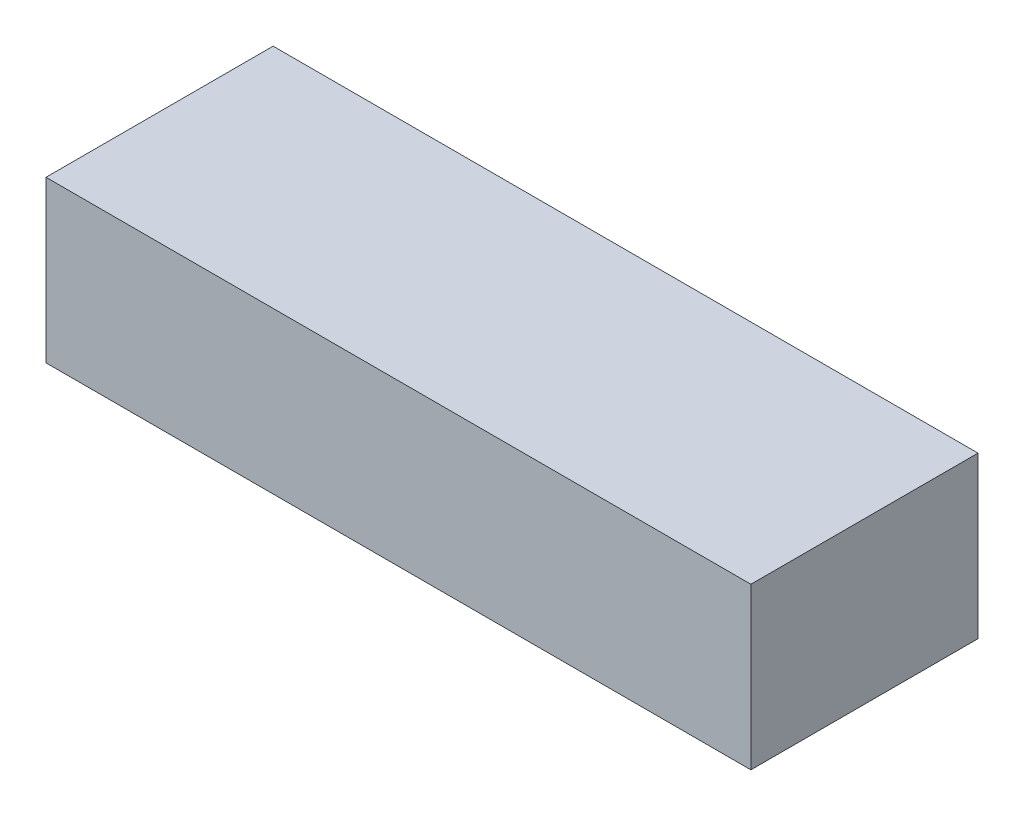
from build123d import *

# Parameters (mm, degrees)
SKETCH1_W           = 135.94
SKETCH1_H           = 43.8
BOSS_EXTRUDE1_DEPTH = 31


with BuildPart() as part:
    # Sketch1 → Boss-Extrude1 (new body)
    with BuildSketch(Plane(origin=(0, 0, 0), x_dir=(1, 0, 0), z_dir=(0, 1, 0))):
        Rectangle(SKETCH1_W, SKETCH1_H)
    extrude(amount=BOSS_EXTRUDE1_DEPTH)


solid = part.part
